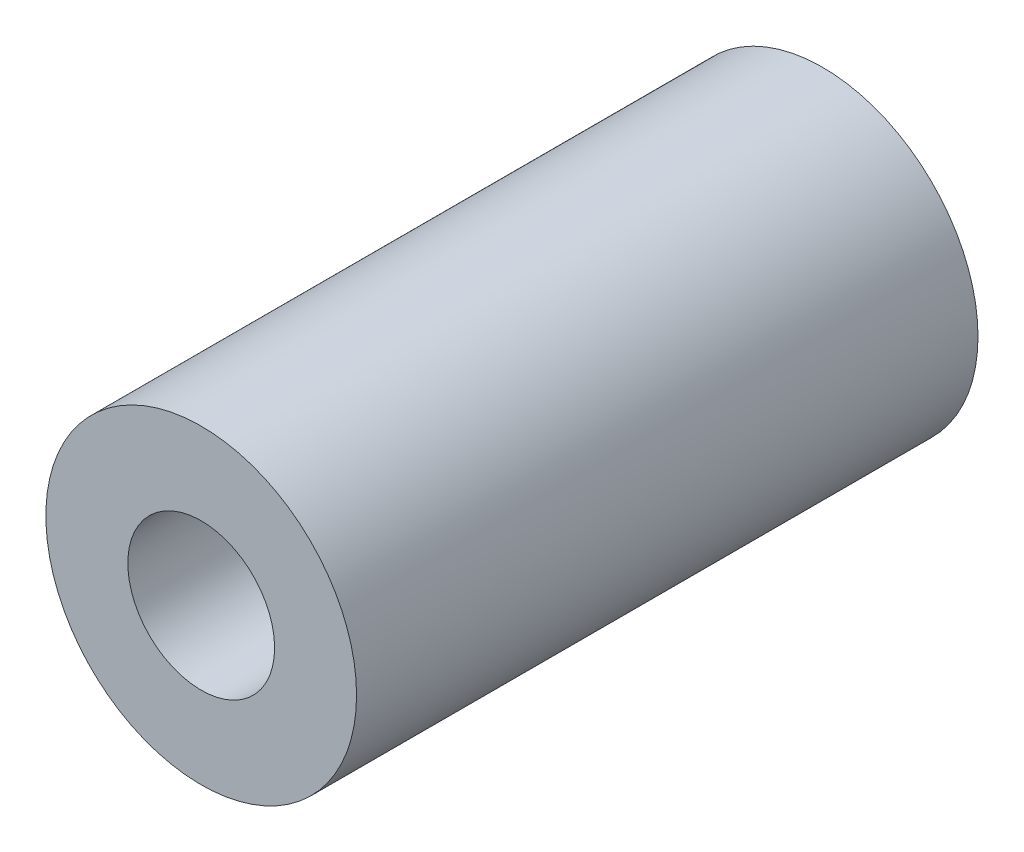
from build123d import *

# Parameters (mm, degrees)
SKETCH1_R           = 4.7625
SKETCH1_R_2         = 2.25
BOSS_EXTRUDE1_DEPTH = 19.05


with BuildPart() as part:
    # Sketch1 → Boss-Extrude1 (new body)
    with BuildSketch(Plane.XY):
        Circle(SKETCH1_R)
        Circle(SKETCH1_R_2, mode=Mode.SUBTRACT)
    extrude(amount=BOSS_EXTRUDE1_DEPTH)


solid = part.part
